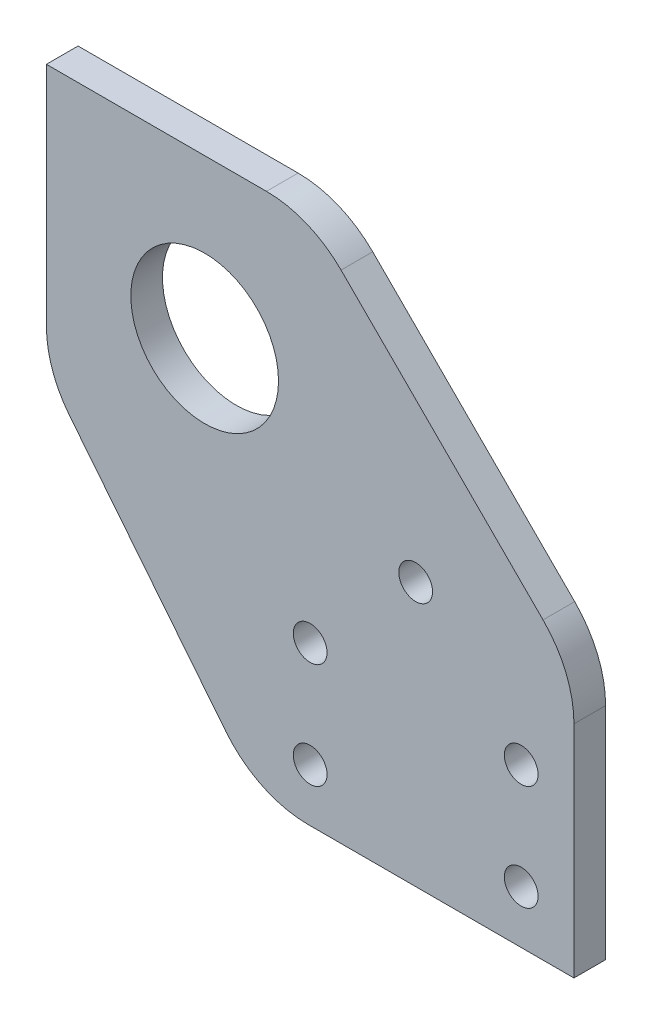
from build123d import *

# Parameters (mm, degrees)
SKETCH_1_W          = 50
SKETCH_1_H          = 50
EXTRUDE_1_DEPTH     = 3
SKETCH_2_R          = 7
SKETCH_2_R_2        = 1.6
CUT_EXTRUDE_1_DEPTH = 71.774289117
CUT_EXTRUDE_2_DEPTH = 71.774289117
FILLET_1_R          = 10


with BuildPart() as part:
    # 草图1 → 凸台-拉伸1 (new body)
    with BuildSketch(Plane.XY):
        with Locations((25, -25)):
            Rectangle(SKETCH_1_W, SKETCH_1_H)
    extrude(amount=EXTRUDE_1_DEPTH)

    # 草图2 → 切除-拉伸1 (cut, through all)
    with BuildSketch(Plane.XY.offset(3)):
        with Locations((15, -15)):
            Circle(SKETCH_2_R)
        with Locations((45, -45)):
            Circle(SKETCH_2_R_2)
        with Locations(Location((45, -35, 0), (0, 0, 180))):
            Circle(SKETCH_2_R_2)
        with Locations((25, -35)):
            Circle(SKETCH_2_R_2)
        with Locations(Location((25, -45, 0), (0, 0, 180))):
            Circle(SKETCH_2_R_2)
        with Locations((35, -25)):
            Circle(SKETCH_2_R_2)
    extrude(amount=-CUT_EXTRUDE_1_DEPTH, mode=Mode.SUBTRACT)

    # 草图3 → 切除-拉伸2 (cut, through all)
    with BuildSketch(Plane.XY.offset(3)):
        Polygon((0, -25), (20, -50), (0, -50), align=None)
        Polygon((25, 0), (50, 0), (50, -25), align=None)
    extrude(amount=-CUT_EXTRUDE_2_DEPTH, mode=Mode.SUBTRACT)

    # 圆角1
    fillet_1_edges = [part.edges().sort_by_distance(p)[0] for p in [
        (0, -25, 1.5),
        (20, -50, 1.5),
        (50, -25, 1.5),
        (25, 0, 1.5),
    ]]
    fillet(fillet_1_edges, radius=FILLET_1_R)


solid = part.part
